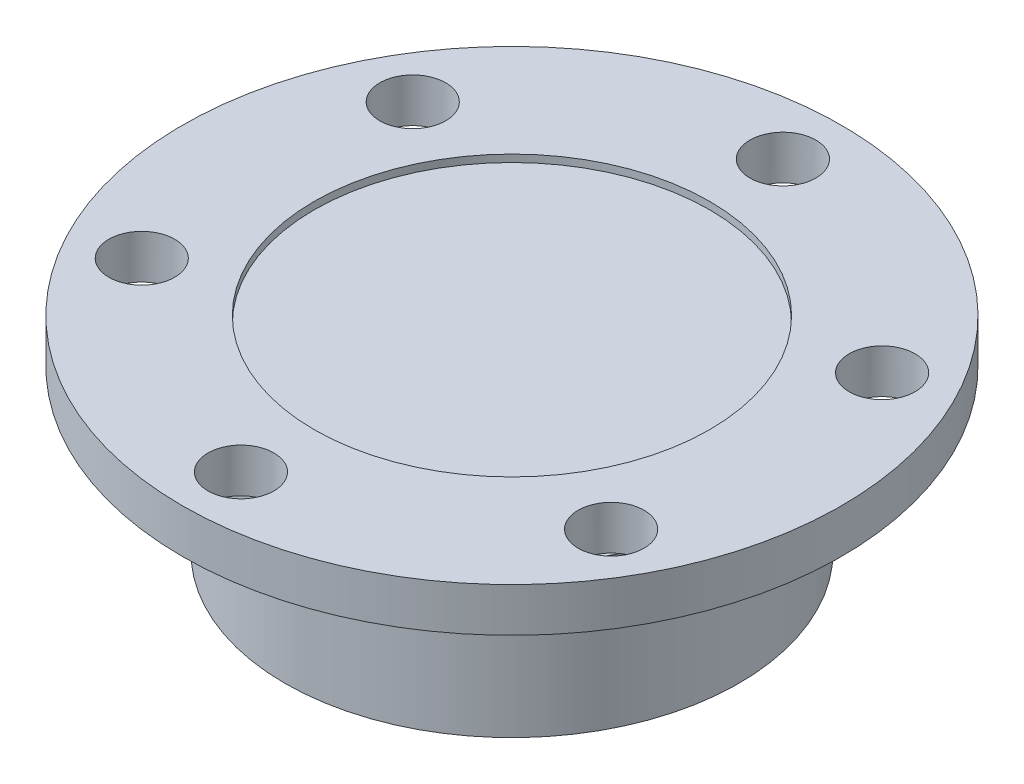
from build123d import *

# Parameters (mm, degrees)
CUT_EXTRUDE1_REACH = 71.527
SKETCH2_R          = 4.5


with BuildPart() as part:
    # Sketch1 → Revolve1 (revolve)
    with BuildSketch(Plane.XY, mode=Mode.PRIVATE) as revolve1_sk:
        Polygon((-45, 28), (-45, 22), (-29.5, 22), (-29.5, 20.5), (-31, 20.5), (-31, 0), (-26.320011027, 0), (-22, 24.5), (0, 24.5), (0, 27), (-27, 27), (-27, 28), align=None)
    revolve(revolve1_sk.sketch.rotate(Axis((0, 30.618797564, 0), (0, -1, 0)), 270), axis=Axis((0, 30.618797564, 0), (0, -1, 0)))

    # Sketch2 → Cut-Extrude1 (cut, up to next)
    with BuildSketch(Plane(origin=(0, 28, 0), x_dir=(1, 0, 0), z_dir=(0, 1, 0)), mode=Mode.PRIVATE) as cut_extrude1_sk1:
        with Locations(Location((0, 37, 0), (0, 0, 270))):
            Circle(SKETCH2_R)
    cut_extrude1_tool1 = extrude(cut_extrude1_sk1.sketch, amount=-CUT_EXTRUDE1_REACH, mode=Mode.PRIVATE) & part.part
    # Sketch2 → Cut-Extrude1 (cut, up to next)
    with BuildSketch(Plane(origin=(0, 28, 0), x_dir=(1, 0, 0), z_dir=(0, 1, 0)), mode=Mode.PRIVATE) as cut_extrude1_sk2:
        with Locations(Location((32.04293994, 18.5, 0), (0, 0, 270))):
            Circle(SKETCH2_R)
    cut_extrude1_tool2 = extrude(cut_extrude1_sk2.sketch, amount=-CUT_EXTRUDE1_REACH, mode=Mode.PRIVATE) & part.part
    # Sketch2 → Cut-Extrude1 (cut, up to next)
    with BuildSketch(Plane(origin=(0, 28, 0), x_dir=(1, 0, 0), z_dir=(0, 1, 0)), mode=Mode.PRIVATE) as cut_extrude1_sk3:
        with Locations(Location((32.04293994, -18.5, 0), (0, 0, 270))):
            Circle(SKETCH2_R)
    cut_extrude1_tool3 = extrude(cut_extrude1_sk3.sketch, amount=-CUT_EXTRUDE1_REACH, mode=Mode.PRIVATE) & part.part
    # Sketch2 → Cut-Extrude1 (cut, up to next)
    with BuildSketch(Plane(origin=(0, 28, 0), x_dir=(1, 0, 0), z_dir=(0, 1, 0)), mode=Mode.PRIVATE) as cut_extrude1_sk4:
        with Locations(Location((0, -37, 0), (0, 0, 270))):
            Circle(SKETCH2_R)
    cut_extrude1_tool4 = extrude(cut_extrude1_sk4.sketch, amount=-CUT_EXTRUDE1_REACH, mode=Mode.PRIVATE) & part.part
    # Sketch2 → Cut-Extrude1 (cut, up to next)
    with BuildSketch(Plane(origin=(0, 28, 0), x_dir=(1, 0, 0), z_dir=(0, 1, 0)), mode=Mode.PRIVATE) as cut_extrude1_sk5:
        with Locations(Location((-32.04293994, -18.5, 0), (0, 0, 270))):
            Circle(SKETCH2_R)
    cut_extrude1_tool5 = extrude(cut_extrude1_sk5.sketch, amount=-CUT_EXTRUDE1_REACH, mode=Mode.PRIVATE) & part.part
    # Sketch2 → Cut-Extrude1 (cut, up to next)
    with BuildSketch(Plane(origin=(0, 28, 0), x_dir=(1, 0, 0), z_dir=(0, 1, 0)), mode=Mode.PRIVATE) as cut_extrude1_sk6:
        with Locations(Location((-32.04293994, 18.5, 0), (0, 0, 270))):
            Circle(SKETCH2_R)
    cut_extrude1_tool6 = extrude(cut_extrude1_sk6.sketch, amount=-CUT_EXTRUDE1_REACH, mode=Mode.PRIVATE) & part.part
    add(cut_extrude1_tool1.solids().sort_by_distance((0, 28, -37))[0], mode=Mode.SUBTRACT)
    add(cut_extrude1_tool2.solids().sort_by_distance((32.04294, 28, -18.5))[0], mode=Mode.SUBTRACT)
    add(cut_extrude1_tool3.solids().sort_by_distance((32.04294, 28, 18.5))[0], mode=Mode.SUBTRACT)
    add(cut_extrude1_tool4.solids().sort_by_distance((0, 28, 37))[0], mode=Mode.SUBTRACT)
    add(cut_extrude1_tool5.solids().sort_by_distance((-32.04294, 28, 18.5))[0], mode=Mode.SUBTRACT)
    add(cut_extrude1_tool6.solids().sort_by_distance((-32.04294, 28, -18.5))[0], mode=Mode.SUBTRACT)


solid = part.part
